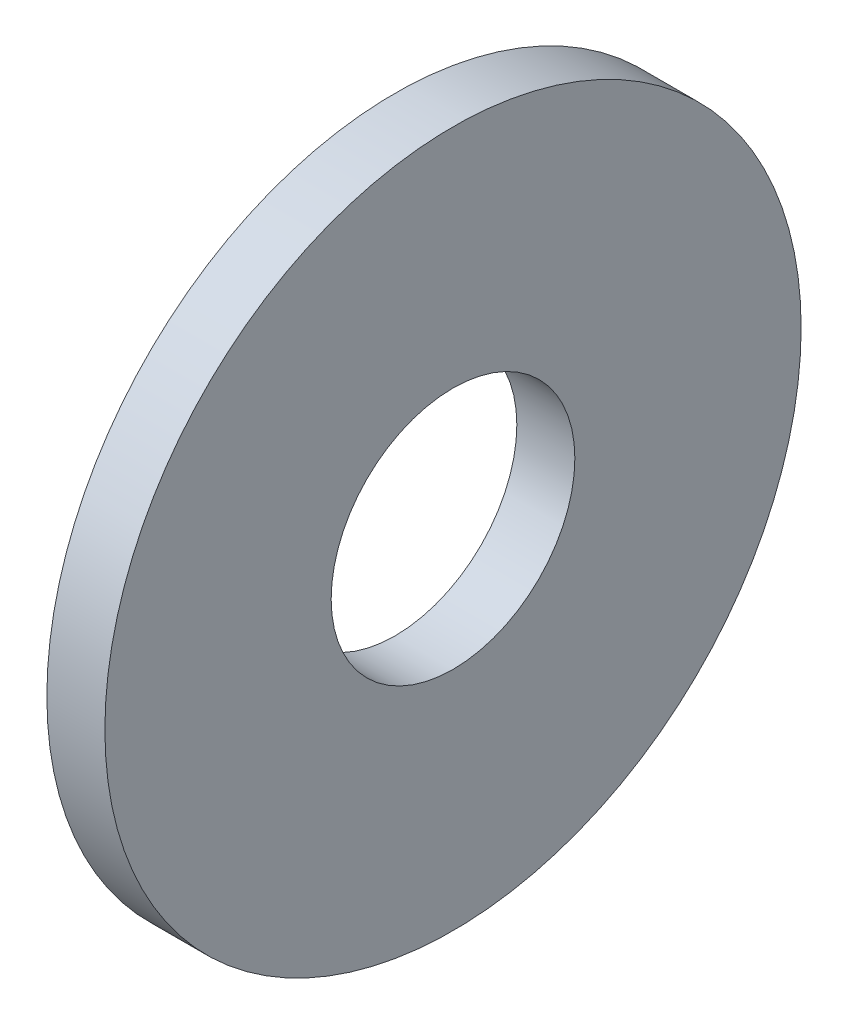
from build123d import *

# Parameters (mm, degrees)
SKETCH1_W = 2.5
SKETCH1_H = 9.75


with BuildPart() as part:
    # Sketch1 → Base-Revolve (revolve)
    with BuildSketch(Plane.XY, mode=Mode.PRIVATE) as base_revolve_sk:
        with Locations((-1.25, 10.125)):
            Rectangle(SKETCH1_W, SKETCH1_H)
    revolve(base_revolve_sk.sketch.rotate(Axis((-34.925, 0, 0), (1, 0, 0)), 90), axis=Axis((-34.925, 0, 0), (1, 0, 0)))


solid = part.part
